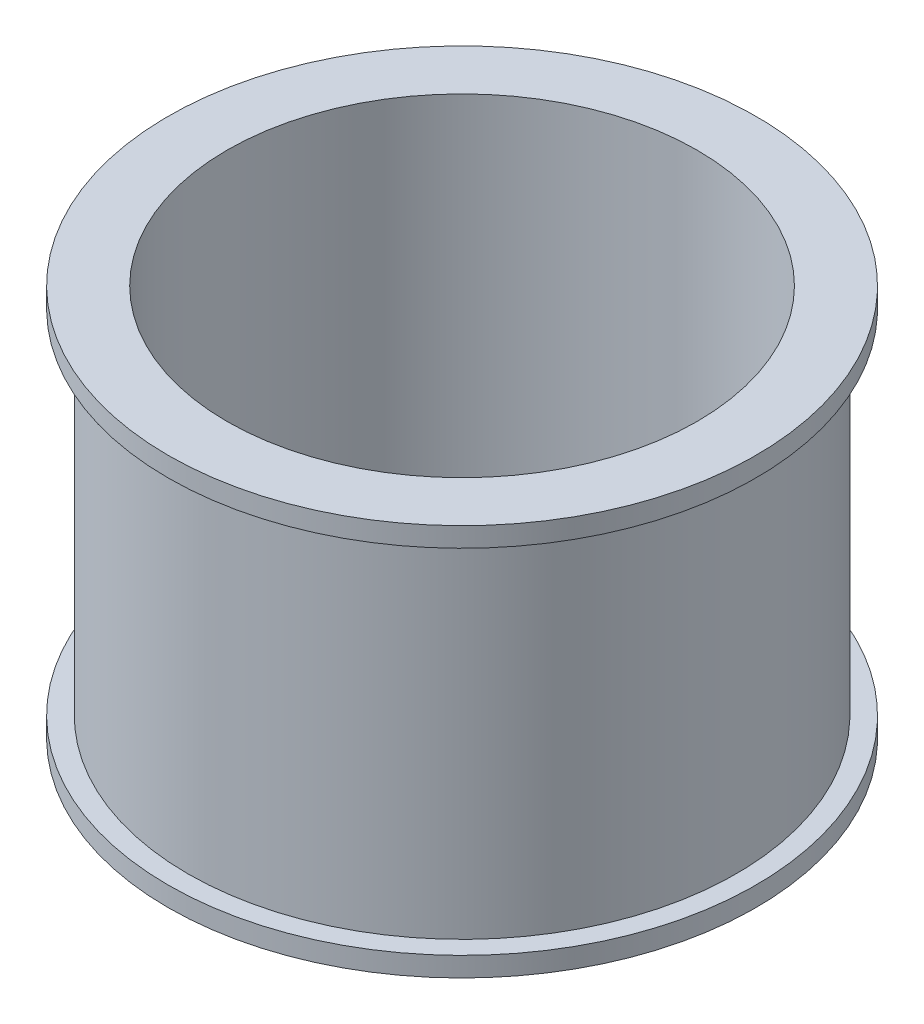
from build123d import *

# Parameters (mm, degrees)
SKETCH1_R           = 3.5
BOSS_EXTRUDE1_DEPTH = 5
SKETCH2_R           = 3
CUT_EXTRUDE1_DEPTH  = 10
BOSS_EXTRUDE2_START = -0.25
SKETCH16_R          = 3.75
SKETCH16_R_2        = 3.5
BOSS_EXTRUDE2_DEPTH = 0.25


with BuildPart() as part:
    # Sketch1 → Boss-Extrude1 (new body)
    with BuildSketch(Plane(origin=(0, 0, 0), x_dir=(1, 0, 0), z_dir=(0, 1, 0))):
        with Locations(Location((0, 0, 0), (0, 0, 270))):
            Circle(SKETCH1_R)
    extrude(amount=BOSS_EXTRUDE1_DEPTH)

    # Sketch2 → Cut-Extrude1 (cut)
    with BuildSketch(Plane(origin=(0, 5, 0), x_dir=(1, 0, 0), z_dir=(0, 1, 0))):
        with Locations(Location((0, 0, 0), (0, 0, 270))):
            Circle(SKETCH2_R)
    extrude(amount=-CUT_EXTRUDE1_DEPTH, mode=Mode.SUBTRACT)

    # Sketch16 → Boss-Extrude2 (add)
    with BuildSketch(Plane(origin=(0, 5, 0), x_dir=(1, 0, 0), z_dir=(0, 1, 0)).offset(BOSS_EXTRUDE2_START)):
        with Locations(Location((0, 0, 0), (0, 0, 270))):
            Circle(SKETCH16_R)
        with Locations(Location((0, 0, 0), (0, 0, 270))):
            Circle(SKETCH16_R_2, mode=Mode.SUBTRACT)
    boss_extrude2 = extrude(amount=BOSS_EXTRUDE2_DEPTH)

    # Mirror1: Boss-Extrude2 across plane
    add(boss_extrude2.mirror(Plane.ZX.offset(2.5)))


solid = part.part
